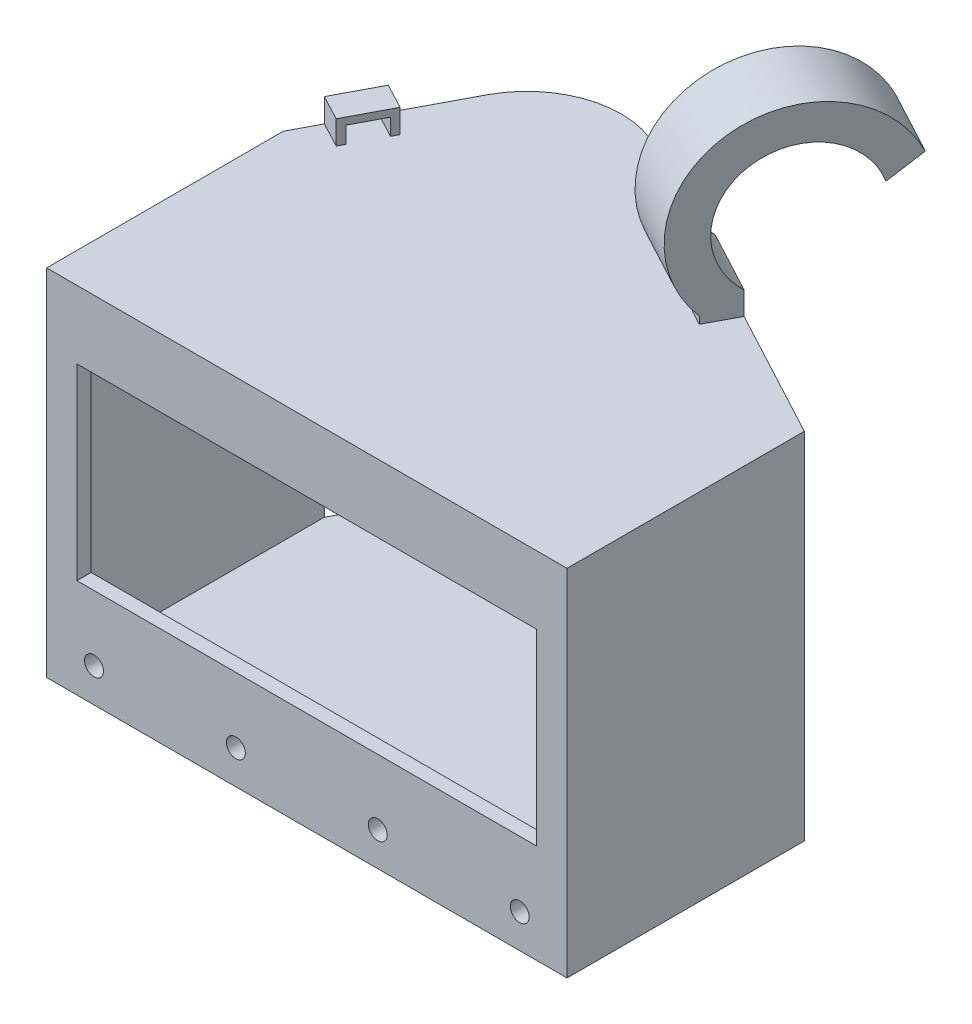
from build123d import *

# Parameters (mm, degrees)
RESSALTO_EXTRUS_O4_DEPTH  = 75
CASCA4_T                  = -3
ESBO_O13_R                = 2
ESBO_O13_W                = 97.172868657
ESBO_O13_H                = 39.686100031
CORTE_EXTRUS_O2_DEPTH     = 75
RESSALTO_EXTRUS_O7_DEPTH  = 5
ESBO_O21_W                = 7
ESBO_O21_H                = 3.5
CORTE_EXTRUS_O7_DEPTH     = 15
RESSALTO_EXTRUS_O9_DEPTH  = 1.5
RESSALTO_EXTRUS_O10_DEPTH = 15
CORTE_EXTRUS_O8_DEPTH     = 9


with BuildPart() as part:
    # Esboço1 → Ressalto-extrusão4 (new body)
    with BuildSketch(Plane(origin=(0, 0, 0), x_dir=(1, 0, 0), z_dir=(0, 1, 0))):
        with BuildLine():
            Line((-61.526708671, 22.298270257), (-61.526708671, -27.701729743))
            Line((-61.526708671, -27.701729743), (48.473291329, -27.701729743))
            Line((48.473291329, -27.701729743), (48.473291329, 22.462720238))
            Line((48.473291329, 22.462720238), (-19.533044421, 58.851024019))
            ThreePointArc((-19.533044421, 58.851024019), (-34.831371888, 60.338136116), (-46.667038922, 50.53164278))
            Line((-46.667038922, 50.53164278), (-61.526708671, 22.298270257))
        make_face()
    extrude(amount=RESSALTO_EXTRUS_O4_DEPTH)

    # Casca4
    casca4_openings = [part.faces().sort_by_distance(p)[0] for p in [
        (-34.831371888, 37.5, -60.338136116),
        (14.470123454, 37.5, -40.656872128),
        (-54.096873797, 37.5, -36.414956518),
    ]]
    offset(amount=CASCA4_T, openings=casca4_openings, kind=Kind.INTERSECTION)

    # Esboço13 → Corte-extrusão2 (cut)
    with BuildSketch(Plane.XY.offset(27.701729743)):
        with Locations((8.473291329, 7.143908188)):
            Circle(ESBO_O13_R)
        with Locations((38.473291329, 7.143908188)):
            Circle(ESBO_O13_R)
        with Locations(Location((-51.526708671, 7.143908188, 0), (0, 0, 180))):
            Circle(ESBO_O13_R)
        with Locations(Location((-21.526708671, 7.143908188, 0), (0, 0, 180))):
            Circle(ESBO_O13_R)
        with Locations((-6.526708671, 40.786037138)):
            Rectangle(ESBO_O13_W, ESBO_O13_H)
    extrude(amount=-CORTE_EXTRUS_O2_DEPTH, mode=Mode.SUBTRACT)

    # Esboço20 → Ressalto-extrusão7 (add)
    with BuildSketch(Plane(origin=(0, 75, 0), x_dir=(1, 0, 0), z_dir=(0, 1, 0))):
        Polygon((-48.559735009, 34.052973883), (-53.869244343, 36.84745248), (-58.526708671, 27.998270257), (-53.217199337, 25.20379166), align=None)
    extrude(amount=RESSALTO_EXTRUS_O7_DEPTH)

    # Esboço21 → Corte-extrusão7 (cut)
    with BuildSketch(Plane(origin=(-52.061018169, 0, -27.400535878), x_dir=(0.46574643283262207, 0, -0.8849182223819825), z_dir=(0.8849182223819825, 0, 0.46574643283262207))):
        with Locations((2.517573756, 76.75)):
            Rectangle(ESBO_O21_W, ESBO_O21_H)
    extrude(amount=-CORTE_EXTRUS_O7_DEPTH, mode=Mode.SUBTRACT)

    # Esboço23 → Ressalto-extrusão9 (add)
    with BuildSketch(Plane(origin=(0, 75, 0), x_dir=(1, 0, 0), z_dir=(0, 1, 0))):
        Polygon((17.78051848, 30.946502751), (21.082988999, 37.118511214), (14.470123454, 40.656872128), (7.857257909, 44.195233042), (4.55478739, 38.023224579), align=None)
    extrude(amount=RESSALTO_EXTRUS_O9_DEPTH)

    # Esboço27 → Ressalto-extrusão10 (add)
    with BuildSketch(Plane(origin=(0.949934773, 0, 0.508283746), x_dir=(0.4717815026852956, 0, -0.8817154947736852), z_dir=(0.8817154947736852, 0, 0.4717815026852957))):
        with BuildLine():
            Line((42.674530712, 76.5), (42.674530712, 79.859907211))
            ThreePointArc((42.674530712, 79.859907211), (43.504490054, 102.339384634), (64.83991575, 95.21089615))
            Line((64.83991575, 95.21089615), (70.983567604, 99.465779677))
            ThreePointArc((70.983567604, 99.465779677), (39.876872471, 108.665113983), (35.674530712, 76.5))
            Line((35.674530712, 76.5), (42.674530712, 76.5))
        make_face()
    extrude(amount=-RESSALTO_EXTRUS_O10_DEPTH)

    # Esboço28 → Corte-extrusão8 (cut)
    with BuildSketch(Plane(origin=(20.133054226, 0, -37.626794961), x_dir=(-0.8817154947736852, 0, -0.4717815026852955), z_dir=(0.4717815026852955, 0, -0.8817154947736852))):
        Polygon((2.309694071, 75), (2.309694071, 77.5), (9.809694071, 77.5), (9.809694071, 75), (6.059694071, 75), align=None)
    extrude(amount=-CORTE_EXTRUS_O8_DEPTH, mode=Mode.SUBTRACT)


solid = part.part
